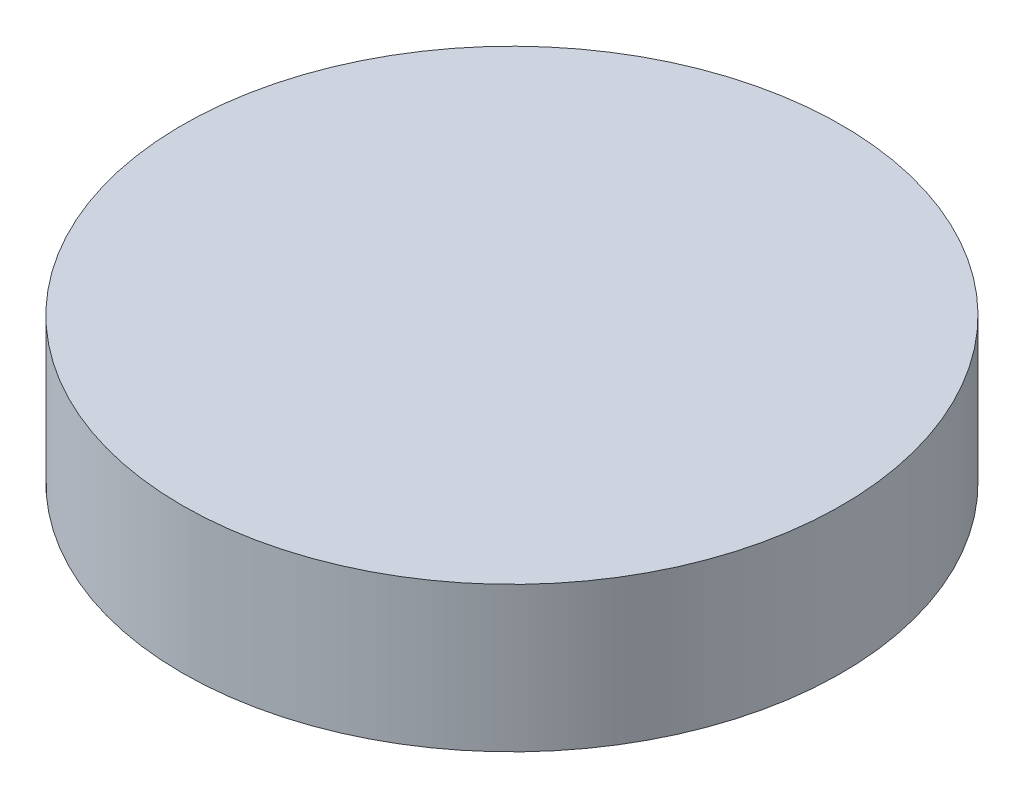
from build123d import *

# Parameters (mm, degrees)
SKETCH1_R           = 72.7
BOSS_EXTRUDE1_DEPTH = 32


with BuildPart() as part:
    # Sketch1 → Boss-Extrude1 (new body)
    with BuildSketch(Plane(origin=(0, 0, 0), x_dir=(1, 0, 0), z_dir=(0, 1, 0))):
        with Locations(Location((0, 0, 0), (0, 0, 270))):
            Circle(SKETCH1_R)
    extrude(amount=BOSS_EXTRUDE1_DEPTH)


solid = part.part
